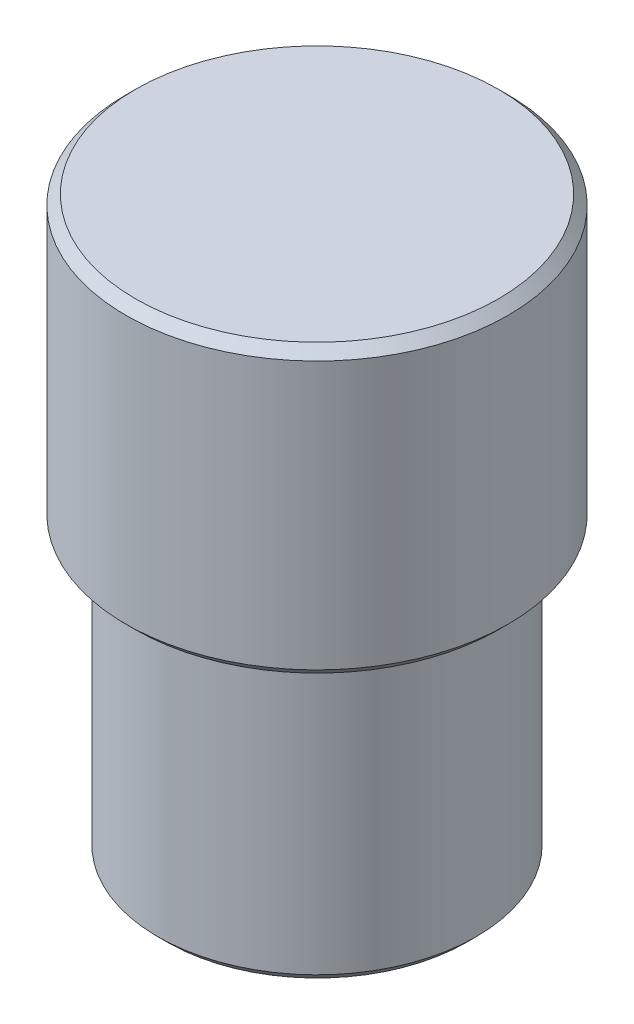
from build123d import *

# Parameters (mm, degrees)
CHAMFER_1_SIZE = 0.3


with BuildPart() as part:
    # 草图1 → 旋转1 (revolve)
    with BuildSketch(Plane.XY):
        Polygon((0, 0), (5, 0), (5, 9), (6, 9), (6, 18), (0, 18), align=None)
    revolve(axis=Axis((0, -1000, 0), (0, 1, 0)))

    # 倒角1
    chamfer_1_edges = [part.edges().sort_by_distance(p)[0] for p in [
        (-6, 18, 0),
        (-6, 9, 0),
        (-5, 0, 0),
    ]]
    chamfer(chamfer_1_edges, length=CHAMFER_1_SIZE)


solid = part.part
